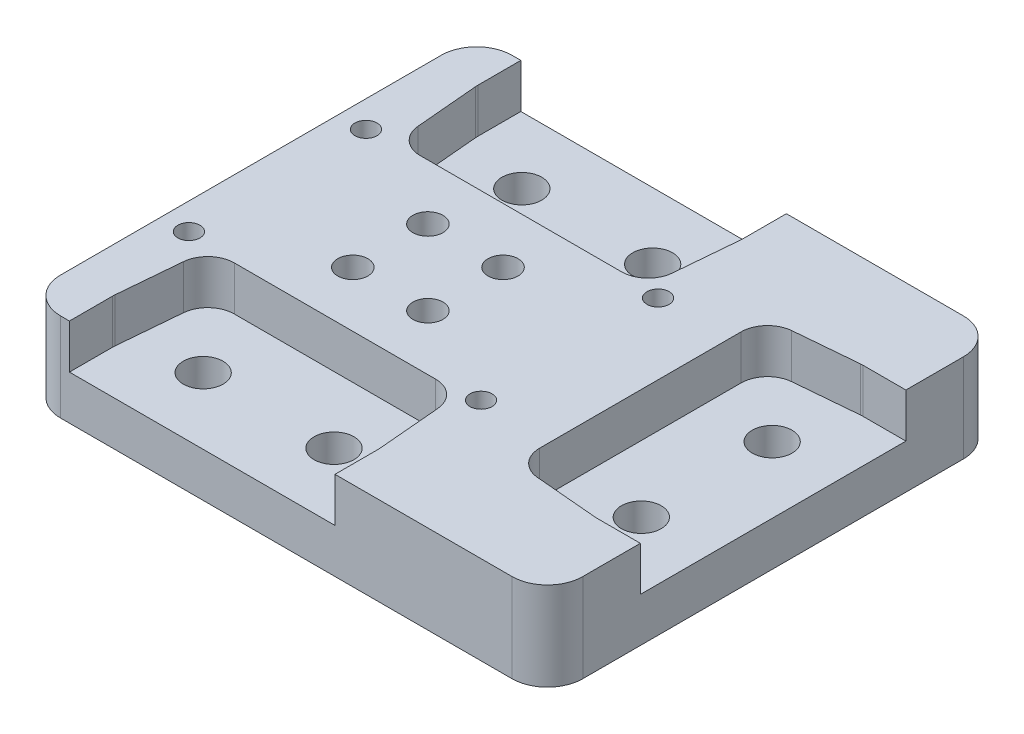
from build123d import *

# Parameters (mm, degrees)
SKETCH_1_W          = 59
SKETCH_1_H          = 51
EXTRUDE_1_DEPTH     = 10
CUT_EXTRUDE_5_DEPTH = 5
HOLE_WIZARD_M31_D   = 3.4
FILLET_1_R          = 4
FILLET_2_R          = 4
CUT_EXTRUDE_6_DEPTH = 5
HOLE_WIZARD_M42_D   = 4.5
M3X0_51_D           = 2.5


with BuildPart() as part:
    # Эскиз1 → Бобышка-Вытянуть1 (new body)
    with BuildSketch(Plane(origin=(0, 0, 0), x_dir=(1, 0, 0), z_dir=(0, 1, 0))):
        with Locations((29.5, 25.5)):
            Rectangle(SKETCH_1_W, SKETCH_1_H)
    extrude(amount=EXTRUDE_1_DEPTH)

    # Эскиз13 → Вырез-Вытянуть5 (cut)
    with BuildSketch(Plane(origin=(28.521351565, 10, -17.681729678), x_dir=(1, 0, 0), z_dir=(0, 1, 0))):
        with BuildLine():
            Line((30.478648435, 22.818270322), (25.609631264, 22.818270322))
            ThreePointArc((25.609631264, 22.818270322), (25.478773101, 22.815414987), (25.348164035, 22.806854417))
            Line((25.348164035, 22.806854417), (18.217181207, 22.182974259))
            ThreePointArc((18.217181207, 22.182974259), (16.266816424, 21.221160788), (15.478648435, 19.194390165))
            Line((15.478648435, 19.194390165), (15.478648435, -3.55784952))
            ThreePointArc((15.478648435, -3.55784952), (16.266816424, -5.584620143), (18.217181207, -6.546433615))
            Line((18.217181207, -6.546433615), (25.348164035, -7.170313772))
            ThreePointArc((25.348164035, -7.170313772), (25.478773101, -7.178874342), (25.609631264, -7.181729678))
            Line((25.609631264, -7.181729678), (30.478648435, -7.181729678))
            Line((30.478648435, -7.181729678), (30.478648435, 22.818270322))
        make_face()
    extrude(amount=-CUT_EXTRUDE_5_DEPTH, mode=Mode.SUBTRACT)

    # Отверстие с зазором M31 (through all)
    with Locations(Plane(origin=(0, 0, 0), x_dir=(-1, 0, 0), z_dir=(0, -1, 0))):
        with Locations((-24.242640687, 29.742640687), (-15.757359313, 29.742640687), (-15.757359313, 21.257359313), (-24.242640687, 21.257359313)):
            Hole(HOLE_WIZARD_M31_D / 2)

    # Скругление1
    fillet_1_edges = [part.edges().sort_by_distance(p)[0] for p in [
        (0, 5, -51),
        (0, 5, 0),
    ]]
    fillet(fillet_1_edges, radius=FILLET_1_R)

    # Скругление2
    fillet_2_edges = [part.edges().sort_by_distance(p)[0] for p in [
        (59, 5, -51),
        (59, 5, 0),
    ]]
    fillet(fillet_2_edges, radius=FILLET_2_R)

    # Эскиз14 → Вырез-Вытянуть6 (cut)
    with BuildSketch(Plane(origin=(28.521351565, 10, -17.681729678), x_dir=(1, 0, 0), z_dir=(0, 1, 0))):
        with BuildLine():
            Line((-23.521351565, -12.812712506), (-23.521351565, -17.681729678))
            Line((-23.521351565, -17.681729678), (6.478648435, -17.681729678))
            Line((6.478648435, -17.681729678), (6.478648435, -12.812712506))
            ThreePointArc((6.478648435, -12.812712506), (6.4757931, -12.681854344), (6.467232529, -12.551245278))
            Line((6.467232529, -12.551245278), (5.843352372, -5.420262449))
            ThreePointArc((5.843352372, -5.420262449), (4.8815389, -3.469897667), (2.854768277, -2.681729678))
            Line((2.854768277, -2.681729678), (-19.897471408, -2.681729678))
            ThreePointArc((-19.897471408, -2.681729678), (-21.924242031, -3.469897667), (-22.886055502, -5.420262449))
            Line((-22.886055502, -5.420262449), (-23.509935659, -12.551245278))
            ThreePointArc((-23.509935659, -12.551245278), (-23.51849623, -12.681854344), (-23.521351565, -12.812712506))
        make_face()
        with BuildLine():
            Line((6.478648435, 28.449253151), (6.478648435, 33.318270322))
            Line((6.478648435, 33.318270322), (-23.521351565, 33.318270322))
            Line((-23.521351565, 33.318270322), (-23.521351565, 28.449253151))
            ThreePointArc((-23.521351565, 28.449253151), (-23.51849623, 28.318394989), (-23.509935659, 28.187785923))
            Line((-23.509935659, 28.187785923), (-22.886055502, 21.056803094))
            ThreePointArc((-22.886055502, 21.056803094), (-21.924242031, 19.106438312), (-19.897471408, 18.318270322))
            Line((-19.897471408, 18.318270322), (2.854768277, 18.318270322))
            ThreePointArc((2.854768277, 18.318270322), (4.8815389, 19.106438312), (5.843352372, 21.056803094))
            Line((5.843352372, 21.056803094), (6.467232529, 28.187785923))
            ThreePointArc((6.467232529, 28.187785923), (6.4757931, 28.318394989), (6.478648435, 28.449253151))
        make_face()
    extrude(amount=-CUT_EXTRUDE_6_DEPTH, mode=Mode.SUBTRACT)

    # Отверстие с зазором M42 (through all)
    with Locations(Plane(origin=(28.521351565, 5, -17.681729678), x_dir=(1, 0, 0), z_dir=(0, 1, 0))):
        with Locations((-15.911990736, 25.818270322), (-1.130712395, 25.818270322), (22.978648435, 15.208909493), (22.978648435, 0.427631152), (-1.130712395, -10.181729678), (-15.911990736, -10.181729678)):
            Hole(HOLE_WIZARD_M42_D / 2)

    # Отверстие обработанное метчиком M3x0.51 (through all)
    with Locations(Plane(origin=(33.500358967, 0, -26.410335717), x_dir=(-1, 0, 0), z_dir=(0, -1, 0))):
        with Locations((30.500358967, -10.910335717), (-2.499641033, -10.910335717), (-2.499641033, 9.089664283), (30.500358967, 9.089664283)):
            Hole(M3X0_51_D / 2)


solid = part.part
